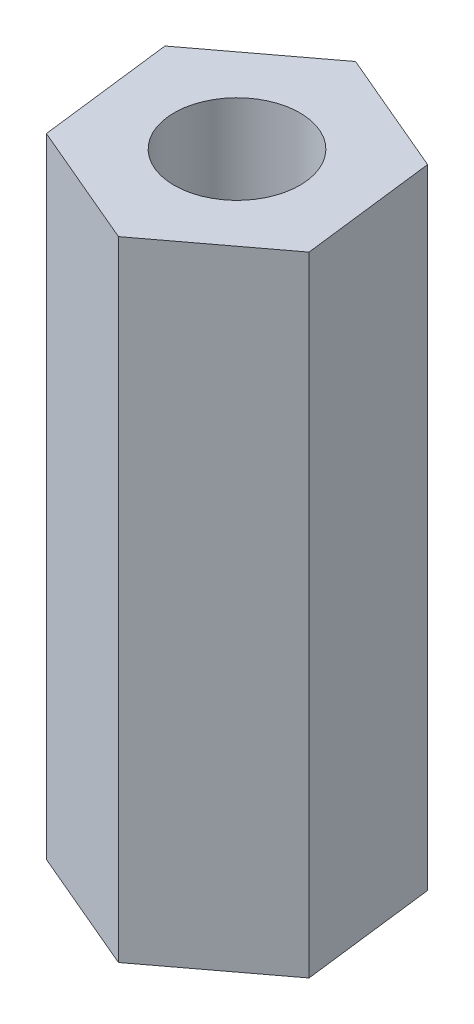
from build123d import *

# Parameters (mm, degrees)
SKETCH_1_R      = 1.6
EXTRUDE_1_DEPTH = 16


with BuildPart() as part:
    # 草图1 → 凸台-拉伸1 (new body)
    with BuildSketch(Plane(origin=(0, 0, 0), x_dir=(1, 0, 0), z_dir=(0, 1, 0))):
        Polygon((2.767176381, 2.083922954), (-0.421142027, 3.438406519), (-3.188318408, 1.354483566), (-2.767176381, -2.083922954), (0.421142027, -3.438406519), (3.188318408, -1.354483566), align=None)
        with Locations(Location((0, 0, 0), (0, 0, 270))):
            Circle(SKETCH_1_R, mode=Mode.SUBTRACT)
    extrude(amount=EXTRUDE_1_DEPTH)


solid = part.part
